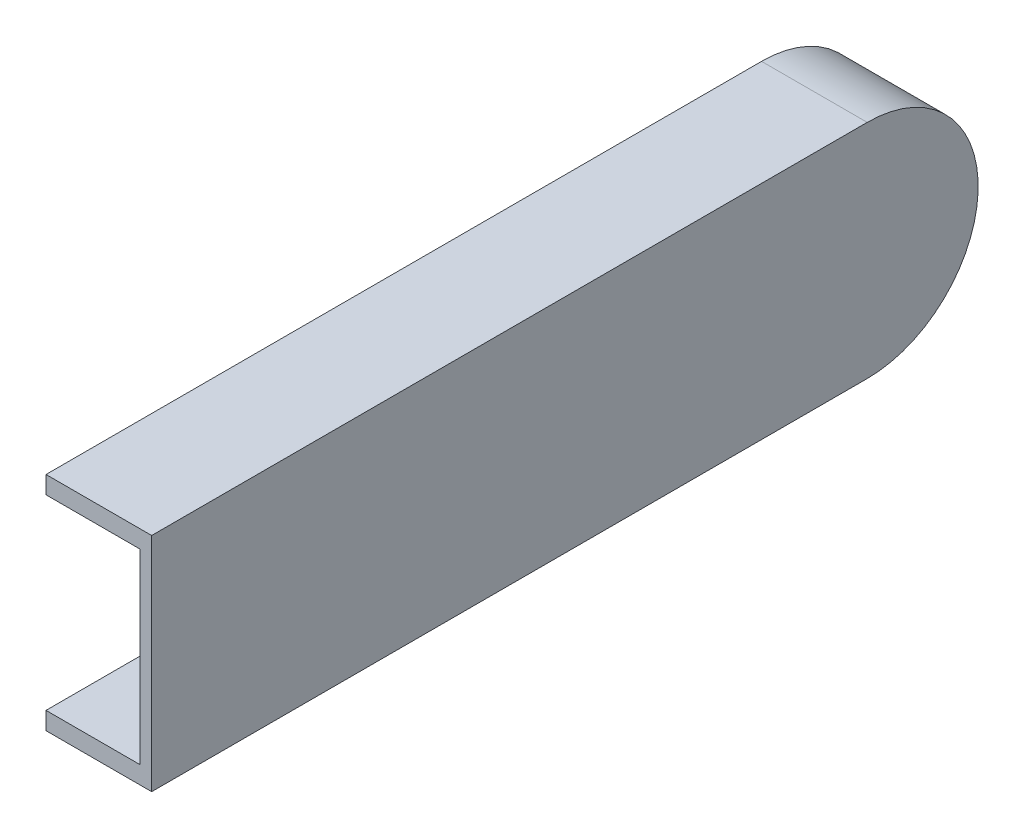
from build123d import *

# Parameters (mm, degrees)
EXTRUDE_1_DEPTH          = 8
EXTRUDE_2_DEPTH          = 1
CUT_EXTRUDE_1_DEPTH      = 43.00279577
CUT_EXTRUDE_1_DEPTH_BACK = 43.00279577


with BuildPart() as part:
    # Эскиз1 → Бобышка-Вытянуть1 (new body)
    with BuildSketch(Plane(origin=(0, 0, 0), x_dir=(0, 0, -1), z_dir=(1, 0, 0))):
        with BuildLine():
            Line((-30.474082362, -9.45), (30.474082362, -9.45))
            ThreePointArc((30.474082362, -9.45), (39.924082362, 0), (30.474082362, 9.45))
            Line((30.474082362, 9.45), (-30.474082362, 9.45))
            ThreePointArc((-30.474082362, 9.45), (-39.924082362, 0), (-30.474082362, -9.45))
        make_face()
        with BuildLine():
            Line((-30.474082362, -7.95), (30.474082362, -7.95))
            ThreePointArc((30.474082362, -7.95), (38.424082362, 0), (30.474082362, 7.95))
            Line((30.474082362, 7.95), (-30.474082362, 7.95))
            ThreePointArc((-30.474082362, 7.95), (-38.424082362, 0), (-30.474082362, -7.95))
        make_face(mode=Mode.SUBTRACT)
    extrude(amount=EXTRUDE_1_DEPTH)

    # Эскиз2 → Бобышка-Вытянуть2 (add)
    with BuildSketch(Plane(origin=(8, 0, 0), x_dir=(0, 0, -1), z_dir=(1, 0, 0))):
        with BuildLine():
            Line((-30.474082362, -9.45), (30.474082362, -9.45))
            ThreePointArc((30.474082362, -9.45), (39.924082362, 0), (30.474082362, 9.45))
            Line((30.474082362, 9.45), (-30.474082362, 9.45))
            ThreePointArc((-30.474082362, 9.45), (-39.924082362, 0), (-30.474082362, -9.45))
        make_face()
    extrude(amount=EXTRUDE_2_DEPTH)

    # Эскиз3 → Вырез-Вытянуть1 (cut, two sides: drawn at the far end of the back side and taken through both)
    with BuildSketch(Plane(origin=(9, 0, 0), x_dir=(0, 0, -1), z_dir=(1, 0, 0)).offset(-CUT_EXTRUDE_1_DEPTH_BACK)):
        Polygon((-30.474082362, 9.45), (-30.474082362, -9.45), (-59.348186325, -9.45), (-44.911134344, 15.375653675), align=None)
    extrude(amount=CUT_EXTRUDE_1_DEPTH + CUT_EXTRUDE_1_DEPTH_BACK, mode=Mode.SUBTRACT)


solid = part.part
